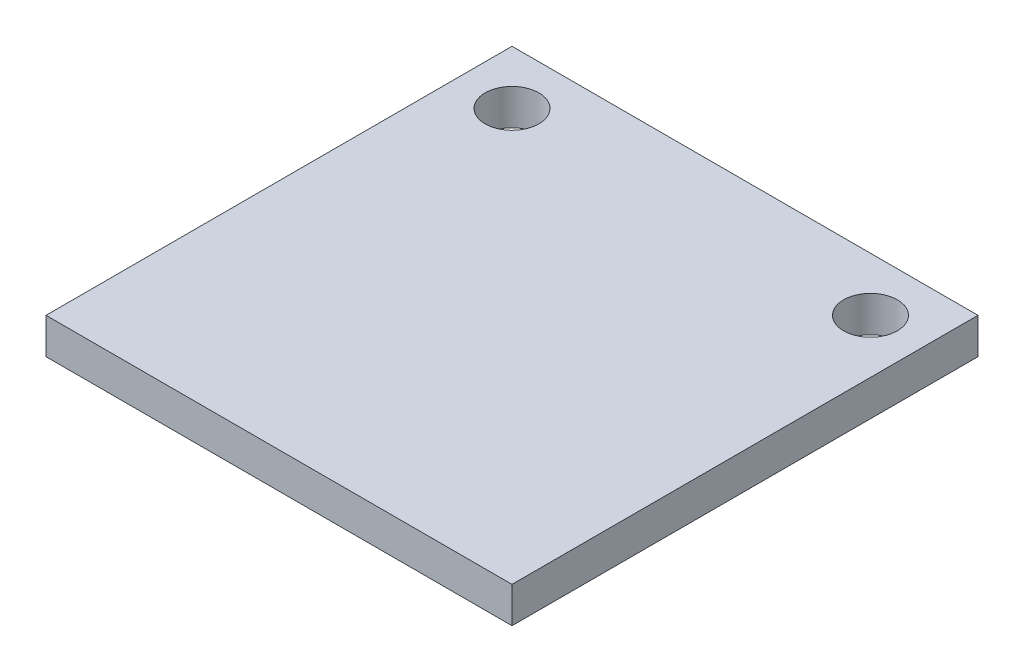
from build123d import *

# Parameters (mm, degrees)
SKETCH1_W           = 26
SKETCH1_H           = 26
SKETCH1_R           = 1.5
BOSS_EXTRUDE1_DEPTH = 2


with BuildPart() as part:
    # Sketch1 → Boss-Extrude1 (new body)
    with BuildSketch(Plane(origin=(0, 0, 0), x_dir=(1, 0, 0), z_dir=(0, 1, 0))):
        Rectangle(SKETCH1_W, SKETCH1_H)
        with Locations(Location((-10, 10, 0), (0, 0, 270))):
            Circle(SKETCH1_R, mode=Mode.SUBTRACT)
        with Locations(Location((10, 10, 0), (0, 0, 270))):
            Circle(SKETCH1_R, mode=Mode.SUBTRACT)
    extrude(amount=BOSS_EXTRUDE1_DEPTH)


solid = part.part
